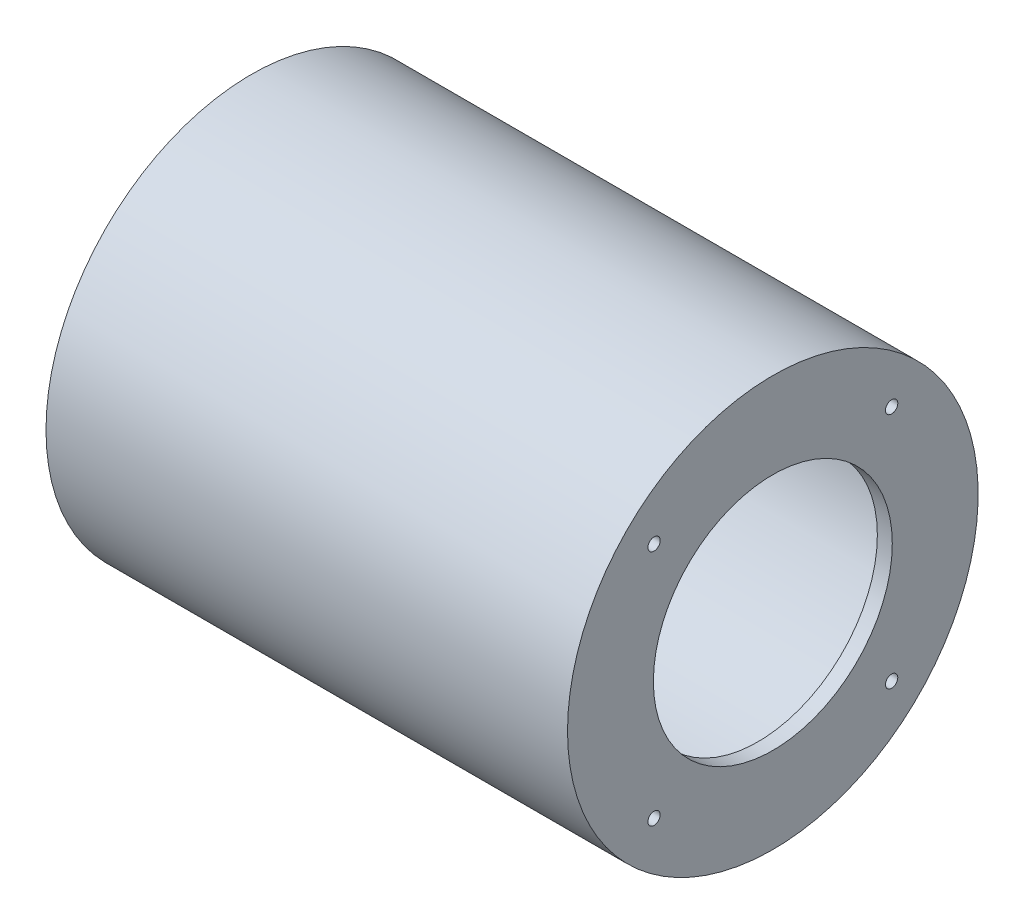
from build123d import *

# Parameters (mm, degrees)
AXIAL_START        = 9.7
SKETCH2_R          = 1.65
AXIAL_HOLES_DEPTH  = 4
CUT_EXTRUDE2_START = -126
SKETCH3_R          = 1.55
CUT_EXTRUDE2_DEPTH = 6


with BuildPart() as part:
    # Axial profile (mm) → Full revolution (revolve)
    with BuildSketch(Plane.XY, mode=Mode.PRIVATE) as full_revolution_sk:
        Polygon((-126, 49), (9.7, 49), (9.7, 32), (13.7, 32), (13.7, 55), (-126, 55), align=None)
    revolve(full_revolution_sk.sketch.rotate(Axis((-110, 0, 0), (1, 0, 0)), 90), axis=Axis((-110, 0, 0), (1, 0, 0)))

    # Sketch2 → Axial holes (cut)
    with BuildSketch(Plane(origin=(0, 0, 0), x_dir=(0, 0, -1), z_dir=(1, 0, 0)).offset(AXIAL_START)):
        with Locations((-31.819805153, 31.819805153)):
            Circle(SKETCH2_R)
        with Locations((-31.819805153, -31.819805153)):
            Circle(SKETCH2_R)
        with Locations((31.819805153, -31.819805153)):
            Circle(SKETCH2_R)
        with Locations((31.819805153, 31.819805153)):
            Circle(SKETCH2_R)
    extrude(amount=AXIAL_HOLES_DEPTH, mode=Mode.SUBTRACT)

    # Sketch3 → Cut-Extrude2 (cut)
    with BuildSketch(Plane(origin=(0, 0, 0), x_dir=(0, 0, -1), z_dir=(1, 0, 0)).offset(CUT_EXTRUDE2_START)):
        with Locations((0, 52)):
            Circle(SKETCH3_R)
        with Locations((-52, 0)):
            Circle(SKETCH3_R)
        with Locations((0, -52)):
            Circle(SKETCH3_R)
        with Locations((52, 0)):
            Circle(SKETCH3_R)
    extrude(amount=CUT_EXTRUDE2_DEPTH, mode=Mode.SUBTRACT)


solid = part.part
